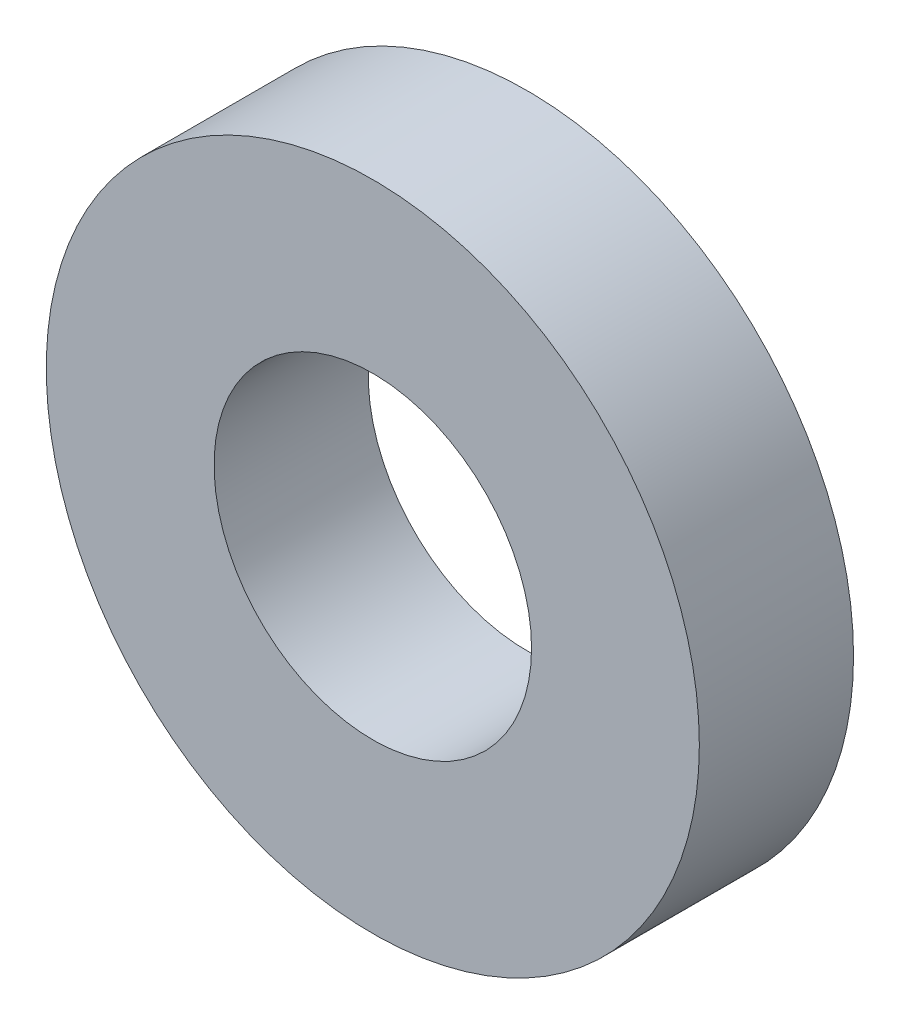
from build123d import *

# Parameters (mm, degrees)
SKETCH1_R           = 36
SKETCH1_R_2         = 17.5
BOSS_EXTRUDE1_DEPTH = 8.5


with BuildPart() as part:
    # Sketch1 → Boss-Extrude1 (new, symmetric)
    with BuildSketch(Plane.XY):
        Circle(SKETCH1_R)
        Circle(SKETCH1_R_2, mode=Mode.SUBTRACT)
    extrude(amount=BOSS_EXTRUDE1_DEPTH, both=True)


solid = part.part
